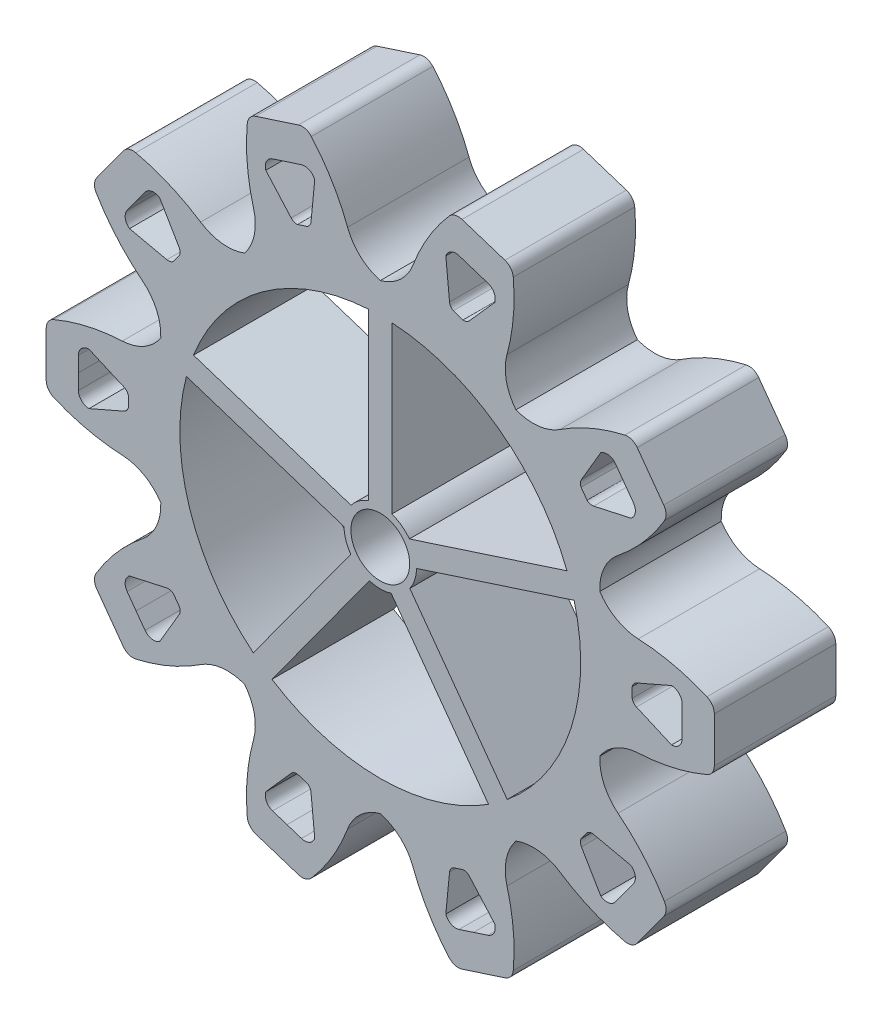
from build123d import *

# Parameters (mm, degrees)
SKETCH1_R           = 96.52
SKETCH1_R_2         = 83.82
SKETCH1_R_3         = 12.283582951
BOSS_EXTRUDE1_DEPTH = 50.8
FILLET1_R           = 5.08
CUT_EXTRUDE1_DEPTH  = 50.8
CIRPATTERN1_COUNT   = 10


with BuildPart() as part:
    # Sketch1 → Boss-Extrude1 (new body)
    # profile 1 of 12: a face of its own
    with BuildSketch(Plane.XY):
        Circle(SKETCH1_R)
        Circle(SKETCH1_R_2, mode=Mode.SUBTRACT)
    # profile 2 of 12: a face of its own
    with BuildSketch(Plane.XY):
        with BuildLine():
            ThreePointArc((4.825304042, 83.680994502), (0, 83.82), (-4.825304042, 83.680994502))
            Line((-4.825304042, 83.680994502), (-4.825304042, 14.375554285))
            ThreePointArc((-4.825304042, 14.375554285), (-8.913044241, 12.26775295), (-12.180863626, 9.03142743))
            Line((-12.180863626, 9.03142743), (-78.094254159, 30.44798626))
            ThreePointArc((-78.094254159, 30.44798626), (-79.717557196, 25.901804469), (-81.076456064, 21.269712555))
            Line((-81.076456064, 21.269712555), (-15.16306553, -0.146846275))
            ThreePointArc((-15.16306553, -0.146846275), (-14.421608526, -4.685864661), (-12.353491775, -8.793825166))
            Line((-12.353491775, -8.793825166), (-53.090207439, -64.863104105))
            ThreePointArc((-53.090207439, -64.863104105), (-49.268159847, -67.811804469), (-45.282701492, -70.535589213))
            Line((-45.282701492, -70.535589213), (-4.545985829, -14.466310274))
            ThreePointArc((-4.545985829, -14.466310274), (0, -15.163776578), (4.545985829, -14.466310274))
            Line((4.545985829, -14.466310274), (45.282701492, -70.535589213))
            ThreePointArc((45.282701492, -70.535589213), (49.268159847, -67.811804469), (53.090207439, -64.863104105))
            Line((53.090207439, -64.863104105), (12.353491775, -8.793825166))
            ThreePointArc((12.353491775, -8.793825166), (14.421608526, -4.685864661), (15.16306553, -0.146846275))
            Line((15.16306553, -0.146846275), (81.076456064, 21.269712555))
            ThreePointArc((81.076456064, 21.269712555), (79.717557196, 25.901804469), (78.094254159, 30.44798626))
            Line((78.094254159, 30.44798626), (12.180863626, 9.03142743))
            ThreePointArc((12.180863626, 9.03142743), (8.913044241, 12.26775295), (4.825304042, 14.375554285))
            Line((4.825304042, 14.375554285), (4.825304042, 83.680994502))
        make_face()
        Circle(SKETCH1_R_3, mode=Mode.SUBTRACT)
    # profile 3 of 12: a face of its own
    with BuildSketch(Plane.XY):
        with BuildLine():
            ThreePointArc((13.681136888, 108.990265778), (8.336247661, 101.114222224), (0, 96.52))
            ThreePointArc((0, 96.52), (29.826320297, 91.795974953), (56.733032551, 78.086320297))
            ThreePointArc((56.733032551, 78.086320297), (52.689282593, 86.703047587), (52.994598623, 96.216547733))
            ThreePointArc((52.994598623, 96.216547733), (55.752590213, 112.464971701), (55.248091871, 128.938079498))
            Line((55.248091871, 128.938079498), (31.091256357, 136.787111155))
            ThreePointArc((31.091256357, 136.787111155), (21.000458803, 123.756623683), (13.681136888, 108.990265778))
        make_face()
    # profile 4 of 12: a face of its own
    with BuildSketch(Plane.XY):
        with BuildLine():
            ThreePointArc((75.131143112, 80.133406739), (66.177614647, 76.903200718), (56.733032551, 78.086320297))
            ThreePointArc((56.733032551, 78.086320297), (78.086320297, 56.733032551), (91.795974953, 29.826320297))
            ThreePointArc((91.795974953, 29.826320297), (93.58929774, 39.1742557), (99.42819868, 46.691378734))
            ThreePointArc((99.42819868, 46.691378734), (111.210044728, 58.215523074), (120.484546818, 71.839083917))
            Line((120.484546818, 71.839083917), (105.55480141, 92.388115574))
            ThreePointArc((105.55480141, 92.388115574), (89.732046335, 87.77745175), (75.131143112, 80.133406739))
        make_face()
    # profile 5 of 12: a face of its own
    with BuildSketch(Plane.XY):
        with BuildLine():
            Line((-31.091256357, 136.787111155), (-55.248091871, 128.938079498))
            ThreePointArc((-55.248091871, 128.938079498), (-55.752590213, 112.464971701), (-52.994598623, 96.216547733))
            ThreePointArc((-52.994598623, 96.216547733), (-52.689282593, 86.703047587), (-56.733032551, 78.086320297))
            ThreePointArc((-56.733032551, 78.086320297), (-29.826320297, 91.795974953), (0, 96.52))
            ThreePointArc((0, 96.52), (-8.336247661, 101.114222224), (-13.681136888, 108.990265778))
            ThreePointArc((-13.681136888, 108.990265778), (-21.000458803, 123.756623683), (-31.091256357, 136.787111155))
        make_face()
    # profile 6 of 12: a face of its own
    with BuildSketch(Plane.XY):
        with BuildLine():
            ThreePointArc((-91.795974953, 29.826320297), (-78.086320297, 56.733032551), (-56.733032551, 78.086320297))
            ThreePointArc((-56.733032551, 78.086320297), (-66.177614647, 76.903200718), (-75.131143112, 80.133406739))
            ThreePointArc((-75.131143112, 80.133406739), (-89.732046335, 87.77745175), (-105.55480141, 92.388115574))
            Line((-105.55480141, 92.388115574), (-120.484546818, 71.839083917))
            ThreePointArc((-120.484546818, 71.839083917), (-111.210044728, 58.215523074), (-99.42819868, 46.691378734))
            ThreePointArc((-99.42819868, 46.691378734), (-93.58929774, 39.1742557), (-91.795974953, 29.826320297))
        make_face()
    # profile 7 of 12: a face of its own
    with BuildSketch(Plane.XY):
        with BuildLine():
            ThreePointArc((-91.795974953, -29.826320297), (-96.52, 0), (-91.795974953, 29.826320297))
            ThreePointArc((-91.795974953, 29.826320297), (-98.741382133, 23.317770381), (-107.883606282, 20.668309959))
            ThreePointArc((-107.883606282, 20.668309959), (-124.189042048, 18.270276695), (-139.7, 12.7))
            Line((-139.7, 12.7), (-139.7, -12.7))
            ThreePointArc((-139.7, -12.7), (-124.189042048, -18.270276695), (-107.883606282, -20.668309959))
            ThreePointArc((-107.883606282, -20.668309959), (-98.741382133, -23.317770381), (-91.795974953, -29.826320297))
        make_face()
    # profile 8 of 12: a face of its own
    with BuildSketch(Plane.XY):
        with BuildLine():
            ThreePointArc((-56.733032551, -78.086320297), (-78.086320297, -56.733032551), (-91.795974953, -29.826320297))
            ThreePointArc((-91.795974953, -29.826320297), (-93.58929774, -39.1742557), (-99.42819868, -46.691378734))
            ThreePointArc((-99.42819868, -46.691378734), (-111.210044728, -58.215523074), (-120.484546818, -71.839083917))
            Line((-120.484546818, -71.839083917), (-105.55480141, -92.388115574))
            ThreePointArc((-105.55480141, -92.388115574), (-89.732046335, -87.77745175), (-75.131143112, -80.133406739))
            ThreePointArc((-75.131143112, -80.133406739), (-66.177614647, -76.903200718), (-56.733032551, -78.086320297))
        make_face()
    # profile 9 of 12: a face of its own
    with BuildSketch(Plane.XY):
        with BuildLine():
            ThreePointArc((0, -96.52), (-29.826320297, -91.795974953), (-56.733032551, -78.086320297))
            ThreePointArc((-56.733032551, -78.086320297), (-52.689282593, -86.703047587), (-52.994598623, -96.216547733))
            ThreePointArc((-52.994598623, -96.216547733), (-55.752590213, -112.464971701), (-55.248091871, -128.938079498))
            Line((-55.248091871, -128.938079498), (-31.091256357, -136.787111155))
            ThreePointArc((-31.091256357, -136.787111155), (-21.000458803, -123.756623683), (-13.681136888, -108.990265778))
            ThreePointArc((-13.681136888, -108.990265778), (-8.336247661, -101.114222224), (0, -96.52))
        make_face()
    # profile 10 of 12: a face of its own
    with BuildSketch(Plane.XY):
        with BuildLine():
            ThreePointArc((56.733032551, -78.086320297), (29.826320297, -91.795974953), (0, -96.52))
            ThreePointArc((0, -96.52), (8.336247661, -101.114222224), (13.681136888, -108.990265778))
            ThreePointArc((13.681136888, -108.990265778), (21.000458803, -123.756623683), (31.091256357, -136.787111155))
            Line((31.091256357, -136.787111155), (55.248091871, -128.938079498))
            ThreePointArc((55.248091871, -128.938079498), (55.752590213, -112.464971701), (52.994598623, -96.216547733))
            ThreePointArc((52.994598623, -96.216547733), (52.689282593, -86.703047587), (56.733032551, -78.086320297))
        make_face()
    # profile 11 of 12: a face of its own
    with BuildSketch(Plane.XY):
        with BuildLine():
            ThreePointArc((99.42819868, -46.691378734), (93.58929774, -39.1742557), (91.795974953, -29.826320297))
            ThreePointArc((91.795974953, -29.826320297), (78.086320297, -56.733032551), (56.733032551, -78.086320297))
            ThreePointArc((56.733032551, -78.086320297), (66.177614647, -76.903200718), (75.131143112, -80.133406739))
            ThreePointArc((75.131143112, -80.133406739), (89.732046335, -87.77745175), (105.55480141, -92.388115574))
            Line((105.55480141, -92.388115574), (120.484546818, -71.839083917))
            ThreePointArc((120.484546818, -71.839083917), (111.210044728, -58.215523074), (99.42819868, -46.691378734))
        make_face()
    # profile 12 of 12: a face of its own
    with BuildSketch(Plane.XY):
        with BuildLine():
            ThreePointArc((107.883606282, 20.668309959), (98.741382133, 23.317770381), (91.795974953, 29.826320297))
            ThreePointArc((91.795974953, 29.826320297), (95.331678634, 15.099054566), (96.52, 0))
            ThreePointArc((96.52, 0), (95.331678634, -15.099054566), (91.795974953, -29.826320297))
            ThreePointArc((91.795974953, -29.826320297), (98.741382133, -23.317770381), (107.883606282, -20.668309959))
            ThreePointArc((107.883606282, -20.668309959), (124.189042048, -18.270276695), (139.7, -12.7))
            Line((139.7, -12.7), (139.7, 12.7))
            ThreePointArc((139.7, 12.7), (124.189042048, 18.270276695), (107.883606282, 20.668309959))
        make_face()
    extrude(amount=BOSS_EXTRUDE1_DEPTH)

    # Fillet1
    fillet1_edges = [part.edges().sort_by_distance(p)[0] for p in [
        (139.7, 12.7, 25.4),
        (139.7, -12.7, 25.4),
        (120.484546818, -71.839083917, 25.4),
        (105.55480141, -92.388115574, 25.4),
        (55.248091871, -128.938079498, 25.4),
        (31.091256357, -136.787111155, 25.4),
        (-31.091256357, -136.787111155, 25.4),
        (-55.248091871, -128.938079498, 25.4),
        (-105.55480141, -92.388115574, 25.4),
        (-120.484546818, -71.839083917, 25.4),
        (-139.7, -12.7, 25.4),
        (-139.7, 12.7, 25.4),
        (-120.484546818, 71.839083917, 25.4),
        (-105.55480141, 92.388115574, 25.4),
        (-55.248091871, 128.938079498, 25.4),
        (-31.091256357, 136.787111155, 25.4),
        (31.091256357, 136.787111155, 25.4),
        (55.248091871, 128.938079498, 25.4),
        (105.55480141, 92.388115574, 25.4),
        (120.484546818, 71.839083917, 25.4),
    ]]
    fillet(fillet1_edges, radius=FILLET1_R)

    # Sketch2 → Cut-Extrude1 (cut)
    with BuildSketch(Plane.XY.offset(50.8)):
        with BuildLine():
            Line((30.537171483, 100.850042132), (34.573076769, 99.538697013))
            ThreePointArc((34.573076769, 99.538697013), (36.040859005, 99.721941024), (37.257549201, 100.563147316))
            Line((37.257549201, 100.563147316), (47.872822058, 112.532549141))
            ThreePointArc((47.872822058, 112.532549141), (47.611562717, 115.884861152), (45.056381909, 118.070565456))
            Line((45.056381909, 118.070565456), (39.004070898, 120.042186886))
            Line((39.004070898, 120.042186886), (32.948758435, 122.004570797))
            ThreePointArc((32.948758435, 122.004570797), (29.596848983, 121.738196466), (27.415046174, 119.179683466))
            Line((27.415046174, 119.179683466), (28.967544444, 103.256733144))
            ThreePointArc((28.967544444, 103.256733144), (29.457418837, 101.861030403), (30.537171483, 100.850042132))
        make_face()
    cut_extrude1 = extrude(amount=-CUT_EXTRUDE1_DEPTH, mode=Mode.SUBTRACT)

    # CirPattern1: Cut-Extrude1 ×10 about axis
    cirpattern1_axis = Axis((0, 0, 0), (0, 0, 1))
    for i in range(1, CIRPATTERN1_COUNT):
        add(cut_extrude1.rotate(cirpattern1_axis, i * 360 / CIRPATTERN1_COUNT), mode=Mode.SUBTRACT)


solid = part.part
